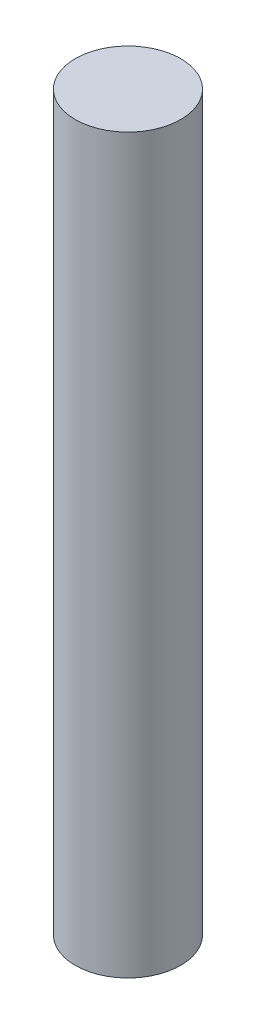
from build123d import *

# Parameters (mm, degrees)
SKETCH_1_R      = 1.8
EXTRUDE_1_DEPTH = 25


with BuildPart() as part:
    # 草图1 → 凸台-拉伸1 (new body)
    with BuildSketch(Plane(origin=(0, 0, 0), x_dir=(1, 0, 0), z_dir=(0, 1, 0))):
        with Locations(Location((0, 0, 0), (0, 0, 270))):
            Circle(SKETCH_1_R)
    extrude(amount=EXTRUDE_1_DEPTH)


solid = part.part
